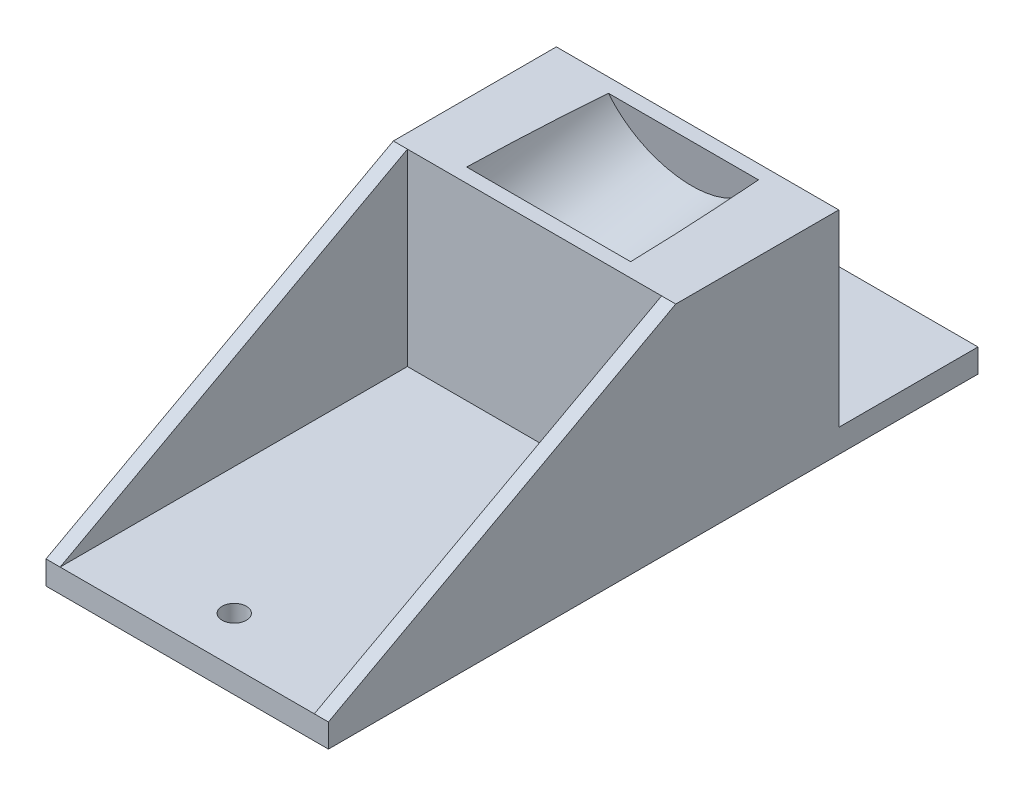
from build123d import *

# Parameters (mm, degrees)
SKETCH7_W                = 76.2
SKETCH7_H                = 88.9
BOSS_EXTRUDE1_DEPTH      = 57.15
BOSS_EXTRUDE2_DEPTH      = 0.127
BOSS_EXTRUDE2_DEPTH_BACK = 35.687
SKETCH8_R                = 22.352
SKETCH10_W               = 30.208401757
SKETCH10_H               = 50.8
SKETCH10_W_2             = 14.705109565
CUT_EXTRUDE2_DEPTH       = 846.764631146
SKETCH11_W               = 76.2
SKETCH11_H               = 6.35
BOSS_EXTRUDE3_DEPTH      = 22.86
SKETCH14_W               = 76.2
SKETCH14_H               = 6.35
BOSS_EXTRUDE4_DEPTH      = 63.5
SKETCH12_R               = 3.2766
CUT_EXTRUDE3_DEPTH       = 720.944943326
RIB5_REACH               = 897.713
SKETCH17_WALL_W          = 1900.017933472
SKETCH17_WALL_H          = 3.81


with BuildPart() as part:
    # Sketch7 → Boss-Extrude1 (new body)
    with BuildSketch(Plane(origin=(0, 474.726, 0), x_dir=(1, 0, 0), z_dir=(0, 1, 0))):
        with Locations((0, -608.711)):
            Rectangle(SKETCH7_W, SKETCH7_H)
    extrude(amount=BOSS_EXTRUDE1_DEPTH)


with BuildPart() as body_2:
    # Sketch8 → Boss-Extrude2 (new, two sides: drawn at the far end of the back side and taken through both)
    with BuildSketch(Plane(origin=(0, -83.644613765, 474.372177356), x_dir=(-1, 0, 0), z_dir=(2.9130205458871294e-15, 0.17364817766694987, -0.9848077530122047)).offset(-BOSS_EXTRUDE2_DEPTH_BACK)):
        with Locations((0, 634.503351151)):
            Circle(SKETCH8_R)
    extrude(amount=BOSS_EXTRUDE2_DEPTH + BOSS_EXTRUDE2_DEPTH_BACK)


with BuildPart() as part_1:
    add(part.part)

    # Combine1: cut body 2
    add(body_2.part, mode=Mode.SUBTRACT)

    # Sketch10 → Cut-Extrude2 (cut, through all)
    with BuildSketch(Plane(origin=(38.1, 0, 0), x_dir=(0, 0, -1), z_dir=(1, 0, 0))):
        with Locations((-638.056799122, 506.476)):
            Rectangle(SKETCH10_W, SKETCH10_H)
        with Locations((-571.613554783, 506.476)):
            Rectangle(SKETCH10_W_2, SKETCH10_H)
    extrude(amount=-CUT_EXTRUDE2_DEPTH, mode=Mode.SUBTRACT)

    # Sketch11 → Boss-Extrude3 (add)
    with BuildSketch(Plane(origin=(0, 0, 564.261), x_dir=(-1, 0, 0), z_dir=(0, 0, -1))):
        with Locations((0, 477.901)):
            Rectangle(SKETCH11_W, SKETCH11_H)
    extrude(amount=BOSS_EXTRUDE3_DEPTH)

    # Sketch14 → Boss-Extrude4 (add)
    with BuildSketch(Plane.XY.offset(653.161)):
        with Locations((0, 477.901)):
            Rectangle(SKETCH14_W, SKETCH14_H)
    extrude(amount=BOSS_EXTRUDE4_DEPTH)

    # Sketch12 → Cut-Extrude3 (cut, through all)
    with BuildSketch(Plane.XZ.offset(-474.726)):
        with Locations((0, 703.961)):
            Circle(SKETCH12_R)
        with Locations((0, 551.561)):
            Circle(SKETCH12_R)
    extrude(amount=-CUT_EXTRUDE3_DEPTH, mode=Mode.SUBTRACT)

    # Sketch17 wall → Rib5 (add, up to next)
    with BuildSketch(Plane(origin=(38.1, 506.476, 669.806799122), x_dir=(0, 0.476582557871, -0.879129720538), z_dir=(0, 0.879129720538, 0.476582557871)), mode=Mode.PRIVATE) as rib5_sk1:
        with Locations((0, 1.905)):
            Rectangle(SKETCH17_WALL_W, SKETCH17_WALL_H)
    rib5_tool1 = extrude(rib5_sk1.sketch, amount=-RIB5_REACH, mode=Mode.PRIVATE) - part_1.part
    rib5 = rib5_tool1.solids().sort_by_distance((38.1, 506.476, 669.806799122))[0]
    add(rib5)

    # Mirror1: Rib5 across plane
    add(rib5.mirror(Plane(origin=(0, 0, 0), x_dir=(0, 0, 1), z_dir=(1, 0, 0))))


solid = part_1.part
